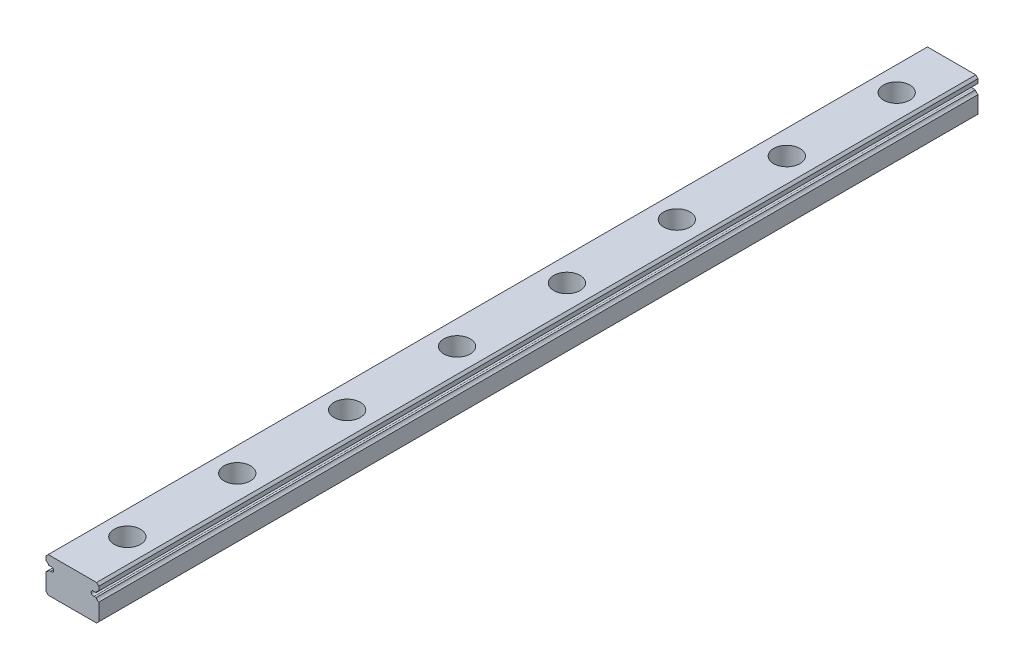
from build123d import *

# Parameters (mm, degrees)
BOSS_EXTRUDE1_DEPTH = 200
SKETCH2_R           = 3
CUT_EXTRUDE1_DEPTH  = 4.5
SKETCH3_R           = 1.75
CUT_EXTRUDE2_DEPTH  = 201.140575596
LPATTERN1_COUNT     = 8
LPATTERN1_PITCH     = 25


with BuildPart() as part:
    # Sketch1 → Boss-Extrude1 (new body)
    with BuildSketch(Plane.XY):
        with BuildLine():
            Line((6, -3.5), (6, 0.368911094))
            ThreePointArc((6, 0.368911094), (5.63354293, 0.61854293), (5.383911094, 0.985))
            Line((5.383911094, 0.985), (4.92112495, 0.985))
            ThreePointArc((4.92112495, 0.985), (4.265, 1.46), (4.92112495, 1.935))
            Line((4.92112495, 1.935), (5.383911094, 1.935))
            ThreePointArc((5.383911094, 1.935), (5.63354293, 2.30145707), (6, 2.551088906))
            Line((6, 2.551088906), (6, 3.5))
            Line((6, 3.5), (5.5, 4))
            Line((5.5, 4), (-5.5, 4))
            Line((-5.5, 4), (-6, 3.5))
            Line((-6, 3.5), (-6, 2.551088906))
            ThreePointArc((-6, 2.551088906), (-5.63354293, 2.30145707), (-5.383911094, 1.935))
            Line((-5.383911094, 1.935), (-4.92112495, 1.935))
            ThreePointArc((-4.92112495, 1.935), (-4.265, 1.46), (-4.92112495, 0.985))
            Line((-4.92112495, 0.985), (-5.383911094, 0.985))
            ThreePointArc((-5.383911094, 0.985), (-5.63354293, 0.61854293), (-6, 0.368911094))
            Line((-6, 0.368911094), (-6, -3.5))
            Line((-6, -3.5), (-5.5, -4))
            Line((-5.5, -4), (5.5, -4))
            Line((5.5, -4), (6, -3.5))
        make_face()
    extrude(amount=BOSS_EXTRUDE1_DEPTH)

    # Sketch2 → Cut-Extrude1 (cut)
    with BuildSketch(Plane(origin=(0, 4, 0), x_dir=(1, 0, 0), z_dir=(0, 1, 0))):
        with Locations(Location((0, -12.5, 0), (0, 0, 180))):
            Circle(SKETCH2_R)
    cut_extrude1 = extrude(amount=-CUT_EXTRUDE1_DEPTH, mode=Mode.SUBTRACT)

    # Sketch3 → Cut-Extrude2 (cut, through all)
    with BuildSketch(Plane(origin=(0, -0.5, 0), x_dir=(1, 0, 0), z_dir=(0, 1, 0))):
        with Locations(Location((0, -12.5, 0), (0, 0, 180))):
            Circle(SKETCH3_R)
    cut_extrude2 = extrude(amount=-CUT_EXTRUDE2_DEPTH, mode=Mode.SUBTRACT)

    # LPattern1: Cut-Extrude1, Cut-Extrude2 ×8
    with Locations(*[(0, 0, i * LPATTERN1_PITCH) for i in range(1, LPATTERN1_COUNT)]):
        add(cut_extrude1, mode=Mode.SUBTRACT)
        add(cut_extrude2, mode=Mode.SUBTRACT)


solid = part.part
